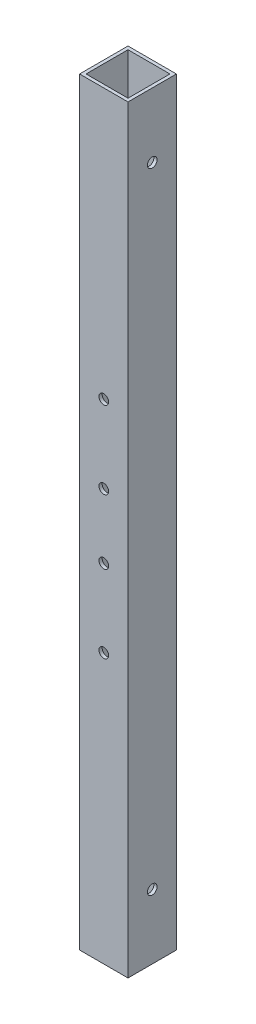
from build123d import *

# Parameters (mm, degrees)
SKETCH_1_W          = 15
SKETCH_1_H          = 15
SKETCH_1_W_2        = 13
SKETCH_1_H_2        = 13
EXTRUDE_1_DEPTH     = 235
SKETCH_2_R          = 1.5
CUT_EXTRUDE_1_DEPTH = 236.597644301
SKETCH_3_R          = 1.5
CUT_EXTRUDE_2_DEPTH = 236.597644301


with BuildPart() as part:
    # 草图1 → 凸台-拉伸1 (new body)
    with BuildSketch(Plane(origin=(0, 0, 0), x_dir=(1, 0, 0), z_dir=(0, 1, 0))):
        Rectangle(SKETCH_1_W, SKETCH_1_H)
        Rectangle(SKETCH_1_W_2, SKETCH_1_H_2, mode=Mode.SUBTRACT)
    extrude(amount=EXTRUDE_1_DEPTH)

    # 草图2 → 切除-拉伸1 (cut, through all)
    with BuildSketch(Plane.XY.offset(7.5)):
        with Locations((0, 127.5)):
            Circle(SKETCH_2_R)
        with Locations((0, 107.5)):
            Circle(SKETCH_2_R)
        with Locations((0, 151.5)):
            Circle(SKETCH_2_R)
        with Locations((0, 83.5)):
            Circle(SKETCH_2_R)
    extrude(amount=-CUT_EXTRUDE_1_DEPTH, mode=Mode.SUBTRACT)

    # 草图3 → 切除-拉伸2 (cut, through all)
    with BuildSketch(Plane(origin=(7.5, 0, 0), x_dir=(0, 0, -1), z_dir=(1, 0, 0))):
        with Locations((0, 215)):
            Circle(SKETCH_3_R)
        with Locations((0, 20)):
            Circle(SKETCH_3_R)
    extrude(amount=-CUT_EXTRUDE_2_DEPTH, mode=Mode.SUBTRACT)


solid = part.part
